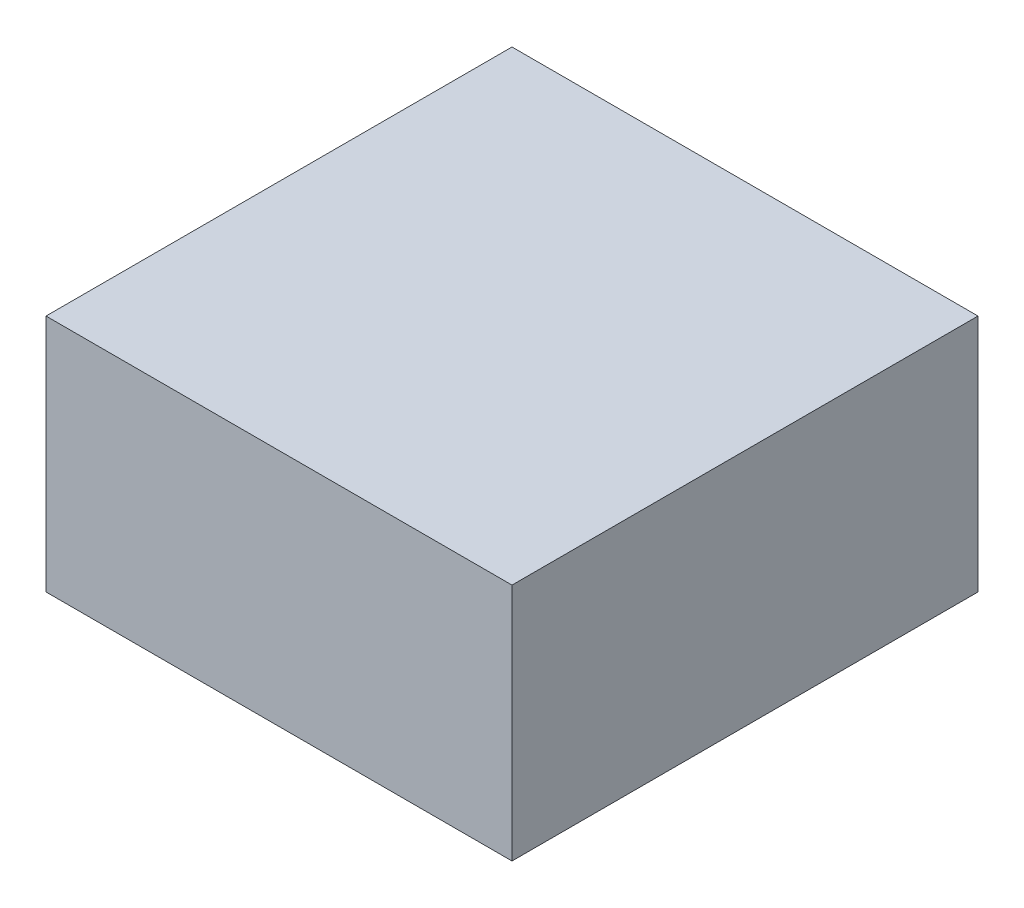
from build123d import *

# Parameters (mm, degrees)
SKETCH1_W           = 7.8
SKETCH1_H           = 7.8
BOSS_EXTRUDE1_DEPTH = 3
SKETCH3_W           = 7.8
SKETCH3_H           = 7.8
BOSS_EXTRUDE2_DEPTH = 1
CUT_EXTRUDE1_DEPTH  = 3


with BuildPart() as part:
    # Sketch1 → Boss-Extrude1 (new body)
    with BuildSketch(Plane(origin=(0, 0, 0), x_dir=(1, 0, 0), z_dir=(0, 1, 0))):
        with Locations((0.315714286, -0.742857143)):
            Rectangle(SKETCH1_W, SKETCH1_H)
    extrude(amount=BOSS_EXTRUDE1_DEPTH)

    # Sketch3 → Boss-Extrude2 (add)
    with BuildSketch(Plane(origin=(0, 3, 0), x_dir=(1, 0, 0), z_dir=(0, 1, 0))):
        with Locations((0.315714286, -0.742857143)):
            Rectangle(SKETCH3_W, SKETCH3_H)
    extrude(amount=BOSS_EXTRUDE2_DEPTH)

    # Sketch4 → Cut-Extrude1 (cut)
    with BuildSketch(Plane.XZ):
        Polygon((0.319353372, 2.24216051), (1.818656739, 2.24216051), (1.818656739, -0.756446224), (-1.179949996, -0.756446224), (-1.179949996, 2.24216051), align=None)
    extrude(amount=-CUT_EXTRUDE1_DEPTH, mode=Mode.SUBTRACT)


solid = part.part
